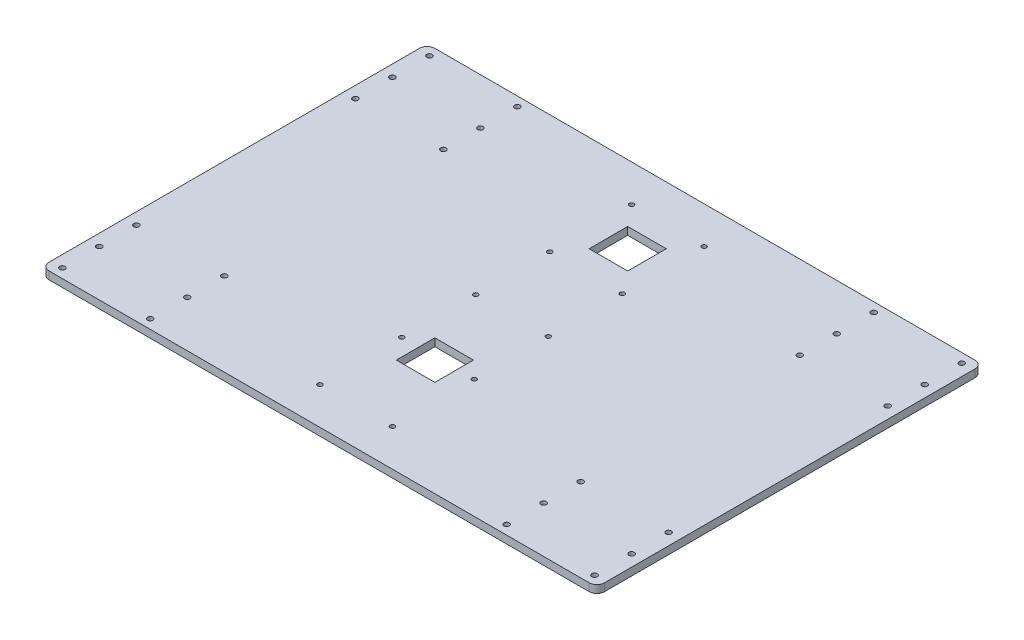
from build123d import *

# Parameters (mm, degrees)
SKETCH2_W           = 360
SKETCH2_H           = 250
SKETCH2_R           = 1.75
SKETCH2_R_2         = 1.5
SKETCH2_W_2         = 25
SKETCH2_H_2         = 25
BOSS_EXTRUDE1_DEPTH = 5
FILLET1_R           = 5


with BuildPart() as part:
    # Sketch2 → Boss-Extrude1 (new body)
    with BuildSketch(Plane(origin=(0, 0, 0), x_dir=(1, 0, 0), z_dir=(0, 1, 0))):
        Rectangle(SKETCH2_W, SKETCH2_H)
        with Locations(Location((-172.5, 95, 0), (0, 0, 270))):
            Circle(SKETCH2_R, mode=Mode.SUBTRACT)
        with Locations(Location((-172.5, 119, 0), (0, 0, 270))):
            Circle(SKETCH2_R, mode=Mode.SUBTRACT)
        with Locations(Location((-172.5, 71, 0), (0, 0, 270))):
            Circle(SKETCH2_R, mode=Mode.SUBTRACT)
        with Locations(Location((-115.5, 119, 0), (0, 0, 90))):
            Circle(SKETCH2_R, mode=Mode.SUBTRACT)
        with Locations(Location((-115.5, 95, 0), (0, 0, 90))):
            Circle(SKETCH2_R, mode=Mode.SUBTRACT)
        with Locations(Location((-115.5, 71, 0), (0, 0, 90))):
            Circle(SKETCH2_R, mode=Mode.SUBTRACT)
        with Locations(Location((172.5, 71, 0), (0, 0, 90))):
            Circle(SKETCH2_R, mode=Mode.SUBTRACT)
        with Locations(Location((172.5, 95, 0), (0, 0, 90))):
            Circle(SKETCH2_R, mode=Mode.SUBTRACT)
        with Locations(Location((172.5, 119, 0), (0, 0, 90))):
            Circle(SKETCH2_R, mode=Mode.SUBTRACT)
        with Locations(Location((115.5, 119, 0), (0, 0, 270))):
            Circle(SKETCH2_R, mode=Mode.SUBTRACT)
        with Locations(Location((115.5, 95, 0), (0, 0, 270))):
            Circle(SKETCH2_R, mode=Mode.SUBTRACT)
        with Locations(Location((115.5, 71, 0), (0, 0, 270))):
            Circle(SKETCH2_R, mode=Mode.SUBTRACT)
        with Locations(Location((-172.5, -119, 0), (0, 0, 90))):
            Circle(SKETCH2_R, mode=Mode.SUBTRACT)
        with Locations(Location((-172.5, -95, 0), (0, 0, 90))):
            Circle(SKETCH2_R, mode=Mode.SUBTRACT)
        with Locations(Location((-172.5, -71, 0), (0, 0, 90))):
            Circle(SKETCH2_R, mode=Mode.SUBTRACT)
        with Locations(Location((-115.5, -119, 0), (0, 0, 270))):
            Circle(SKETCH2_R, mode=Mode.SUBTRACT)
        with Locations(Location((-115.5, -95, 0), (0, 0, 270))):
            Circle(SKETCH2_R, mode=Mode.SUBTRACT)
        with Locations(Location((-115.5, -71, 0), (0, 0, 270))):
            Circle(SKETCH2_R, mode=Mode.SUBTRACT)
        with Locations(Location((115.5, -71, 0), (0, 0, 90))):
            Circle(SKETCH2_R, mode=Mode.SUBTRACT)
        with Locations(Location((115.5, -95, 0), (0, 0, 90))):
            Circle(SKETCH2_R, mode=Mode.SUBTRACT)
        with Locations(Location((115.5, -119, 0), (0, 0, 90))):
            Circle(SKETCH2_R, mode=Mode.SUBTRACT)
        with Locations(Location((172.5, -119, 0), (0, 0, 270))):
            Circle(SKETCH2_R, mode=Mode.SUBTRACT)
        with Locations(Location((172.5, -95, 0), (0, 0, 270))):
            Circle(SKETCH2_R, mode=Mode.SUBTRACT)
        with Locations(Location((172.5, -71, 0), (0, 0, 270))):
            Circle(SKETCH2_R, mode=Mode.SUBTRACT)
        with Locations(Location((-23.5, 101, 0), (0, 0, 270))):
            Circle(SKETCH2_R_2, mode=Mode.SUBTRACT)
        with Locations(Location((-23.5, -101, 0), (0, 0, 90))):
            Circle(SKETCH2_R_2, mode=Mode.SUBTRACT)
        with Locations(Location((-23.5, 0, 0), (0, 0, 270))):
            Circle(SKETCH2_R_2, mode=Mode.SUBTRACT)
        with Locations(Location((-23.5, 48, 0), (0, 0, 270))):
            Circle(SKETCH2_R_2, mode=Mode.SUBTRACT)
        with Locations(Location((-23.5, -48, 0), (0, 0, 270))):
            Circle(SKETCH2_R_2, mode=Mode.SUBTRACT)
        with Locations(Location((23.5, 101, 0), (0, 0, 90))):
            Circle(SKETCH2_R_2, mode=Mode.SUBTRACT)
        with Locations(Location((23.5, 48, 0), (0, 0, 90))):
            Circle(SKETCH2_R_2, mode=Mode.SUBTRACT)
        with Locations(Location((23.5, 0, 0), (0, 0, 90))):
            Circle(SKETCH2_R_2, mode=Mode.SUBTRACT)
        with Locations(Location((23.5, -48, 0), (0, 0, 90))):
            Circle(SKETCH2_R_2, mode=Mode.SUBTRACT)
        with Locations(Location((23.5, -101, 0), (0, 0, 270))):
            Circle(SKETCH2_R_2, mode=Mode.SUBTRACT)
        with Locations((0, 75)):
            Rectangle(SKETCH2_W_2, SKETCH2_H_2, mode=Mode.SUBTRACT)
        with Locations((0, -50)):
            Rectangle(SKETCH2_W_2, SKETCH2_H_2, mode=Mode.SUBTRACT)
    extrude(amount=BOSS_EXTRUDE1_DEPTH)

    # Fillet1
    fillet1_edges = [part.edges().sort_by_distance(p)[0] for p in [
        (-180, 2.5, -125),
        (180, 2.5, -125),
        (180, 2.5, 125),
        (-180, 2.5, 125),
    ]]
    fillet(fillet1_edges, radius=FILLET1_R)


solid = part.part
